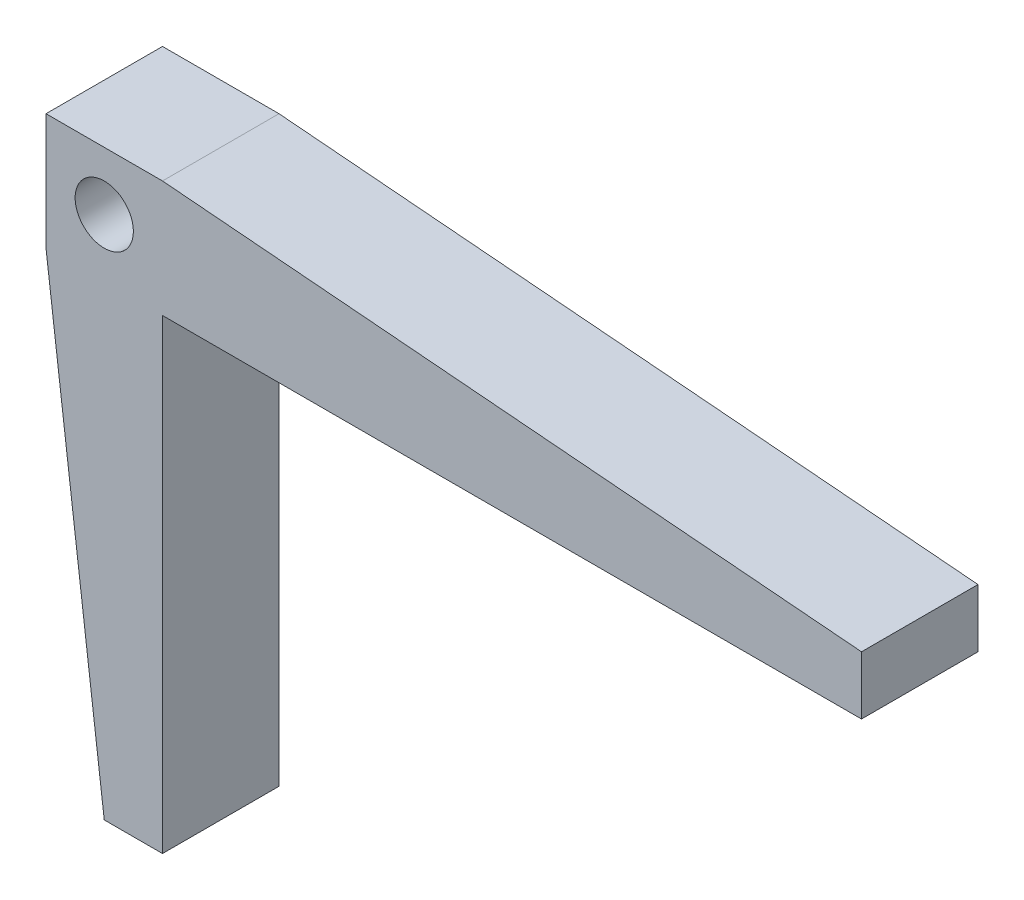
from build123d import *

# Parameters (mm, degrees)
SKETCH1_R           = 6.35
BOSS_EXTRUDE1_DEPTH = 25.4


with BuildPart() as part:
    # Sketch1 → Boss-Extrude1 (new body)
    with BuildSketch(Plane.XY):
        Polygon((0, 0), (0, -101.6), (-12.7, -101.6), (-25.4, 0), (-25.4, 25.4), (0, 25.4), (152.4, 12.7), (152.4, 0), align=None)
        with Locations((-12.7, 12.7)):
            Circle(SKETCH1_R, mode=Mode.SUBTRACT)
    extrude(amount=BOSS_EXTRUDE1_DEPTH)


solid = part.part
